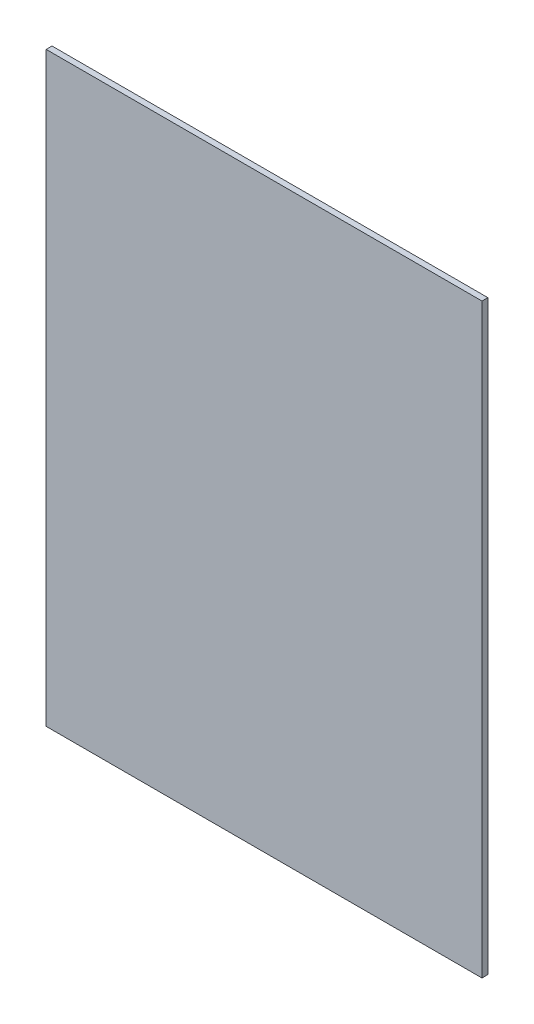
from build123d import *

# Parameters (mm, degrees)
SKETCH_1_W      = 223
SKETCH_1_H      = 300
EXTRUDE_1_DEPTH = 3


with BuildPart() as part:
    # 草图1 → 凸台-拉伸1 (new body)
    with BuildSketch(Plane.XY):
        Rectangle(SKETCH_1_W, SKETCH_1_H)
    extrude(amount=EXTRUDE_1_DEPTH)


solid = part.part
